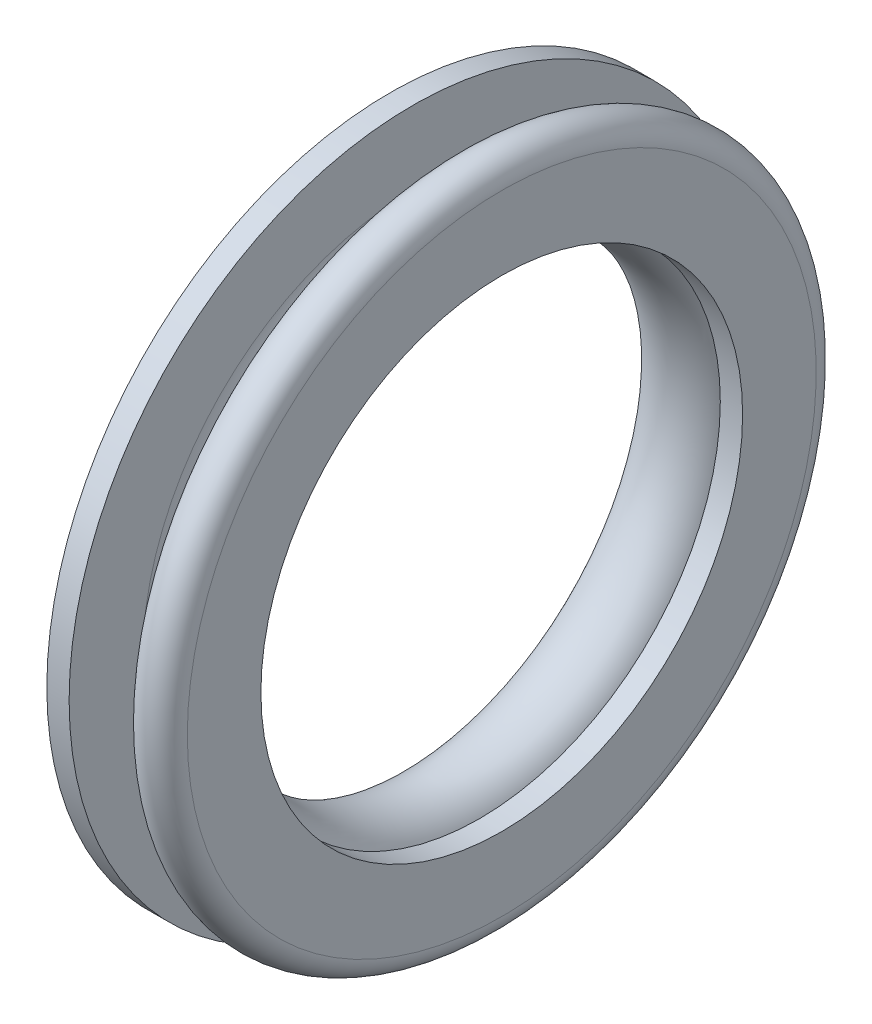
from build123d import *


with BuildPart() as part:
    # Sketch1 → Revolve1 (revolve)
    with BuildSketch(Plane.XY, mode=Mode.PRIVATE) as revolve1_sk:
        with BuildLine():
            Line((0, 7.7), (0, 6.05))
            ThreePointArc((0, 6.05), (1, 5.05), (2, 6.05))
            Line((2, 6.05), (2, 5.4))
            Line((2, 5.4), (2.5, 5.4))
            Line((2.5, 5.4), (2.5, 7.05))
            ThreePointArc((2.5, 7.05), (2, 7.55), (1.5, 7.05))
            Line((1.5, 7.05), (1.5, 6.05))
            ThreePointArc((1.5, 6.05), (1, 5.55), (0.5, 6.05))
            Line((0.5, 6.05), (0.5, 7.7))
            Line((0.5, 7.7), (0, 7.7))
        make_face()
    revolve(revolve1_sk.sketch.rotate(Axis((0, 0, 0), (1, 0, 0)), 90), axis=Axis((0, 0, 0), (1, 0, 0)))


solid = part.part
